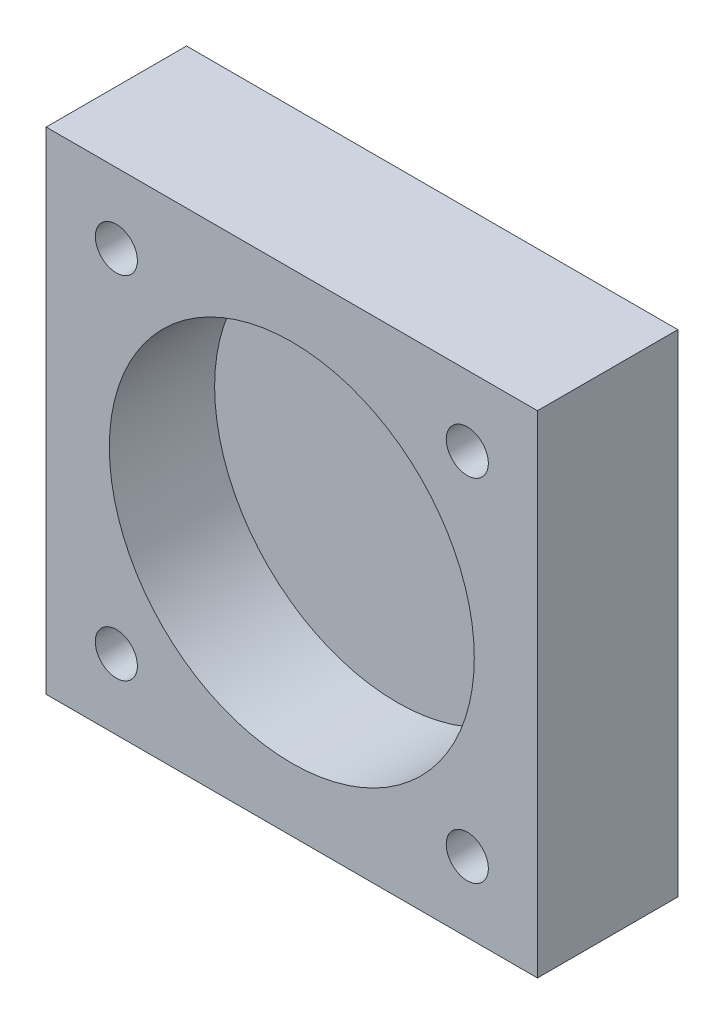
from build123d import *

# Parameters (mm, degrees)
ESQUISSE1_W                  = 70
ESQUISSE1_H                  = 70
BOSS_EXTRU_1_DEPTH           = 20
ENL_V_MAT_EXTRU_1_DEPTH      = 54.38539126
ENL_V_MAT_EXTRU_1_DEPTH_BACK = 15
ESQUISSE2_R                  = 26
ESQUISSE3_R                  = 3
ENL_V_MAT_EXTRU_2_DEPTH      = 54.38539126


with BuildPart() as part:
    # Esquisse1 → Boss.-Extru.1 (new body)
    with BuildSketch(Plane.XY):
        Rectangle(ESQUISSE1_W, ESQUISSE1_H)
    extrude(amount=-BOSS_EXTRU_1_DEPTH)

    # Esquisse2 → Enlèv. mat.-Extru.1 (cut, two sides: drawn at the far end of the back side and taken through both)
    with BuildSketch(Plane.XY.offset(-ENL_V_MAT_EXTRU_1_DEPTH_BACK)):
        Circle(ESQUISSE2_R)
    extrude(amount=ENL_V_MAT_EXTRU_1_DEPTH + ENL_V_MAT_EXTRU_1_DEPTH_BACK, mode=Mode.SUBTRACT)

    # Esquisse3 → Enlèv. mat.-Extru.2 (cut, through all)
    with BuildSketch(Plane(origin=(0, 0, -20), x_dir=(-1, 0, 0), z_dir=(0, 0, -1))):
        with Locations((-25, 25)):
            Circle(ESQUISSE3_R)
        with Locations((25, 25)):
            Circle(ESQUISSE3_R)
        with Locations((25, -25)):
            Circle(ESQUISSE3_R)
        with Locations((-25, -25)):
            Circle(ESQUISSE3_R)
    extrude(amount=-ENL_V_MAT_EXTRU_2_DEPTH, mode=Mode.SUBTRACT)


solid = part.part
